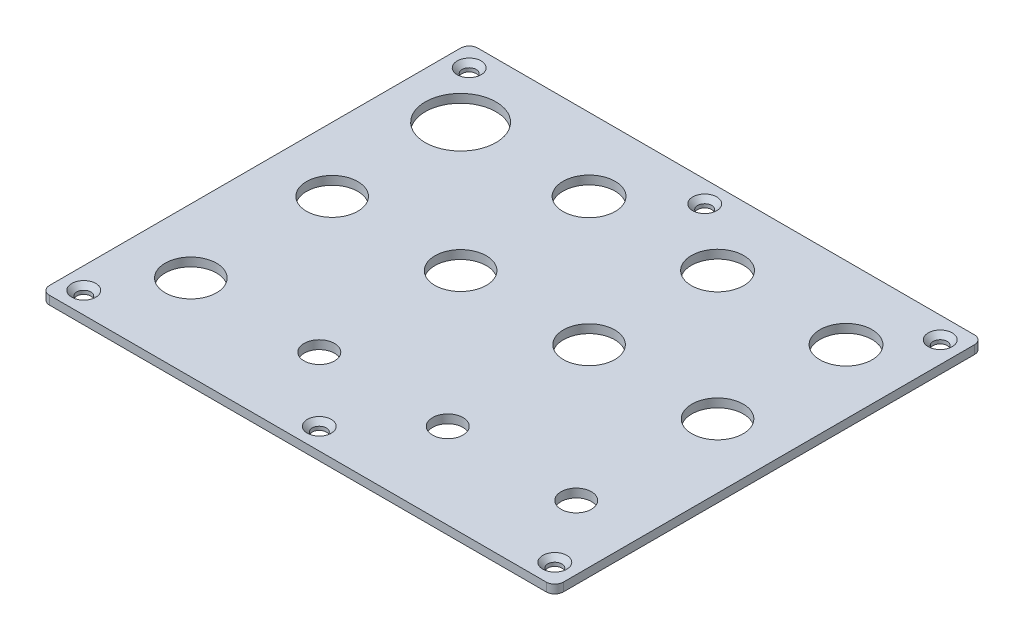
from build123d import *

# Parameters (mm, degrees)
BOTTOM_PLATE_W                       = 120
BOTTOM_PLATE_H                       = 100
BOTTOM_PLATE_EXT_DEPTH               = 2
MIDDLE_ROW_R                         = 6
MIDDLE_ROW_CUT_DEPTH                 = 157.217796681
TOP_ROW_R                            = 8.25
TOP_ROW_R_2                          = 6.1
TOP_ROW_CUT_DEPTH                    = 157.217796681
BOTTOM_ROW_R                         = 3.55
BOTTOM_ROW_R_2                       = 6
BOTTOM_ROW_CUT_DEPTH                 = 157.217796681
PLATE_SCREWS_R                       = 1.65
PLATE_SCREWS_CUT_DEPTH               = 157.217796681
PLATE_SCREW_HEAD_R                   = 2.8
PLATE_SCREW_HEAD_CUT_DEPTH           = 2
PLATE_SCREW_HEAD_CUT_DRAFT           = -45
PLATE_SCREW_HEAD_CUT_PROFILE_2_DEPTH = 2
PLATE_SCREW_HEAD_CUT_PROFILE_2_DRAFT = -45
PLATE_SCREW_HEAD_CUT_PROFILE_3_DEPTH = 2
PLATE_SCREW_HEAD_CUT_PROFILE_3_DRAFT = -45
PLATE_SCREW_HEAD_CUT_PROFILE_4_DEPTH = 2
PLATE_SCREW_HEAD_CUT_PROFILE_4_DRAFT = -45
PLATE_SCREW_HEAD_CUT_PROFILE_5_DEPTH = 2
PLATE_SCREW_HEAD_CUT_PROFILE_5_DRAFT = -45
PLATE_SCREW_HEAD_CUT_PROFILE_6_DEPTH = 2
PLATE_SCREW_HEAD_CUT_PROFILE_6_DRAFT = -45
FILLET1_R                            = 2
FILLET2_R                            = 2
FILLET3_R                            = 2
FILLET4_R                            = 2


with BuildPart() as part:
    # Bottom Plate → Bottom Plate EXT (new body)
    with BuildSketch(Plane(origin=(0, 0, 0), x_dir=(1, 0, 0), z_dir=(0, 1, 0))):
        with Locations((-60, 50)):
            Rectangle(BOTTOM_PLATE_W, BOTTOM_PLATE_H)
    extrude(amount=BOTTOM_PLATE_EXT_DEPTH)

    # Middle Row → Middle Row Cut (cut, through all)
    with BuildSketch(Plane(origin=(0, 2, 0), x_dir=(1, 0, 0), z_dir=(0, 1, 0))):
        with Locations(Location((-105, 53, 0), (0, 0, 270))):
            Circle(MIDDLE_ROW_R)
        with Locations(Location((-75, 53, 0), (0, 0, 270))):
            Circle(MIDDLE_ROW_R)
        with Locations(Location((-45, 53, 0), (0, 0, 270))):
            Circle(MIDDLE_ROW_R)
        with Locations(Location((-15, 53, 0), (0, 0, 270))):
            Circle(MIDDLE_ROW_R)
    extrude(amount=-MIDDLE_ROW_CUT_DEPTH, mode=Mode.SUBTRACT)

    # Top Row → Top Row Cut (cut, through all)
    with BuildSketch(Plane(origin=(0, 2, 0), x_dir=(1, 0, 0), z_dir=(0, 1, 0))):
        with Locations(Location((-105, 83, 0), (0, 0, 270))):
            Circle(TOP_ROW_R)
        with Locations(Location((-75, 83, 0), (0, 0, 270))):
            Circle(TOP_ROW_R_2)
        with Locations(Location((-45, 83, 0), (0, 0, 270))):
            Circle(TOP_ROW_R_2)
        with Locations(Location((-15, 83, 0), (0, 0, 270))):
            Circle(TOP_ROW_R_2)
    extrude(amount=-TOP_ROW_CUT_DEPTH, mode=Mode.SUBTRACT)

    # Bottom Row → Bottom Row Cut (cut, through all)
    with BuildSketch(Plane(origin=(0, 2, 0), x_dir=(1, 0, 0), z_dir=(0, 1, 0))):
        with Locations(Location((-75, 20, 0), (0, 0, 270))):
            Circle(BOTTOM_ROW_R)
        with Locations(Location((-45, 20, 0), (0, 0, 270))):
            Circle(BOTTOM_ROW_R)
        with Locations(Location((-15, 20, 0), (0, 0, 270))):
            Circle(BOTTOM_ROW_R)
        with Locations(Location((-105, 20, 0), (0, 0, 270))):
            Circle(BOTTOM_ROW_R_2)
    extrude(amount=-BOTTOM_ROW_CUT_DEPTH, mode=Mode.SUBTRACT)

    # Plate Screws → Plate Screws Cut (cut, through all)
    with BuildSketch(Plane(origin=(0, 2, 0), x_dir=(1, 0, 0), z_dir=(0, 1, 0))):
        with Locations(Location((-115, 95, 0), (0, 0, 270))):
            Circle(PLATE_SCREWS_R)
        with Locations(Location((-5, 95, 0), (0, 0, 270))):
            Circle(PLATE_SCREWS_R)
        with Locations(Location((-5, 5, 0), (0, 0, 270))):
            Circle(PLATE_SCREWS_R)
        with Locations(Location((-115, 5, 0), (0, 0, 270))):
            Circle(PLATE_SCREWS_R)
        with Locations(Location((-60, 95, 0), (0, 0, 270))):
            Circle(PLATE_SCREWS_R)
        with Locations(Location((-60, 5, 0), (0, 0, 90))):
            Circle(PLATE_SCREWS_R)
    extrude(amount=-PLATE_SCREWS_CUT_DEPTH, mode=Mode.SUBTRACT)


with BuildPart() as plate_screw_head_cut_tool:
    # Plate Screw Head → Plate Screw Head Cut (with draft: the straight prism first)
    with BuildSketch(Plane(origin=(0, 2, 0), x_dir=(1, 0, 0), z_dir=(0, 1, 0))):
        with Locations((-115, 95)):
            Circle(PLATE_SCREW_HEAD_R)
    extrude(amount=-PLATE_SCREW_HEAD_CUT_DEPTH)
    # Plate Screw Head Cut: the draft: its side faces are tilted about the plane it starts from
    plate_screw_head_cut_sides = [plate_screw_head_cut_tool.faces().sort_by_distance(p)[0] for p in [
        (-117.8, 1, -95),
    ]]
    draft(plate_screw_head_cut_sides, Plane(origin=(0, 2, 0), x_dir=(1, 0, 0), z_dir=(0, 1, 0)), PLATE_SCREW_HEAD_CUT_DRAFT)


with BuildPart() as part_1:
    add(part.part)

    # Plate Screw Head Cut: cut by plate_screw_head_cut_tool
    add(plate_screw_head_cut_tool.part, mode=Mode.SUBTRACT)


with BuildPart() as plate_screw_head_cut_profile_2_tool:
    # Plate Screw Head → Plate Screw Head Cut profile 2 (with draft: the straight prism first)
    with BuildSketch(Plane(origin=(0, 2, 0), x_dir=(1, 0, 0), z_dir=(0, 1, 0))):
        with Locations((-5, 95)):
            Circle(PLATE_SCREW_HEAD_R)
    extrude(amount=-PLATE_SCREW_HEAD_CUT_PROFILE_2_DEPTH)
    # Plate Screw Head Cut profile 2: the draft: its side faces are tilted about the plane it starts from
    plate_screw_head_cut_profile_2_sides = [plate_screw_head_cut_profile_2_tool.faces().sort_by_distance(p)[0] for p in [
        (-7.8, 1, -95),
    ]]
    draft(plate_screw_head_cut_profile_2_sides, Plane(origin=(0, 2, 0), x_dir=(1, 0, 0), z_dir=(0, 1, 0)), PLATE_SCREW_HEAD_CUT_PROFILE_2_DRAFT)


with BuildPart() as part_2:
    add(part_1.part)

    # Plate Screw Head Cut profile 2: cut by plate_screw_head_cut_profile_2_tool
    add(plate_screw_head_cut_profile_2_tool.part, mode=Mode.SUBTRACT)


with BuildPart() as plate_screw_head_cut_profile_3_tool:
    # Plate Screw Head → Plate Screw Head Cut profile 3 (with draft: the straight prism first)
    with BuildSketch(Plane(origin=(0, 2, 0), x_dir=(1, 0, 0), z_dir=(0, 1, 0))):
        with Locations((-5, 5)):
            Circle(PLATE_SCREW_HEAD_R)
    extrude(amount=-PLATE_SCREW_HEAD_CUT_PROFILE_3_DEPTH)
    # Plate Screw Head Cut profile 3: the draft: its side faces are tilted about the plane it starts from
    plate_screw_head_cut_profile_3_sides = [plate_screw_head_cut_profile_3_tool.faces().sort_by_distance(p)[0] for p in [
        (-7.8, 1, -5),
    ]]
    draft(plate_screw_head_cut_profile_3_sides, Plane(origin=(0, 2, 0), x_dir=(1, 0, 0), z_dir=(0, 1, 0)), PLATE_SCREW_HEAD_CUT_PROFILE_3_DRAFT)


with BuildPart() as part_3:
    add(part_2.part)

    # Plate Screw Head Cut profile 3: cut by plate_screw_head_cut_profile_3_tool
    add(plate_screw_head_cut_profile_3_tool.part, mode=Mode.SUBTRACT)


with BuildPart() as plate_screw_head_cut_profile_4_tool:
    # Plate Screw Head → Plate Screw Head Cut profile 4 (with draft: the straight prism first)
    with BuildSketch(Plane(origin=(0, 2, 0), x_dir=(1, 0, 0), z_dir=(0, 1, 0))):
        with Locations((-115, 5)):
            Circle(PLATE_SCREW_HEAD_R)
    extrude(amount=-PLATE_SCREW_HEAD_CUT_PROFILE_4_DEPTH)
    # Plate Screw Head Cut profile 4: the draft: its side faces are tilted about the plane it starts from
    plate_screw_head_cut_profile_4_sides = [plate_screw_head_cut_profile_4_tool.faces().sort_by_distance(p)[0] for p in [
        (-117.8, 1, -5),
    ]]
    draft(plate_screw_head_cut_profile_4_sides, Plane(origin=(0, 2, 0), x_dir=(1, 0, 0), z_dir=(0, 1, 0)), PLATE_SCREW_HEAD_CUT_PROFILE_4_DRAFT)


with BuildPart() as part_4:
    add(part_3.part)

    # Plate Screw Head Cut profile 4: cut by plate_screw_head_cut_profile_4_tool
    add(plate_screw_head_cut_profile_4_tool.part, mode=Mode.SUBTRACT)


with BuildPart() as plate_screw_head_cut_profile_5_tool:
    # Plate Screw Head → Plate Screw Head Cut profile 5 (with draft: the straight prism first)
    with BuildSketch(Plane(origin=(0, 2, 0), x_dir=(1, 0, 0), z_dir=(0, 1, 0))):
        with Locations((-60, 95)):
            Circle(PLATE_SCREW_HEAD_R)
    extrude(amount=-PLATE_SCREW_HEAD_CUT_PROFILE_5_DEPTH)
    # Plate Screw Head Cut profile 5: the draft: its side faces are tilted about the plane it starts from
    plate_screw_head_cut_profile_5_sides = [plate_screw_head_cut_profile_5_tool.faces().sort_by_distance(p)[0] for p in [
        (-62.8, 1, -95),
    ]]
    draft(plate_screw_head_cut_profile_5_sides, Plane(origin=(0, 2, 0), x_dir=(1, 0, 0), z_dir=(0, 1, 0)), PLATE_SCREW_HEAD_CUT_PROFILE_5_DRAFT)


with BuildPart() as part_5:
    add(part_4.part)

    # Plate Screw Head Cut profile 5: cut by plate_screw_head_cut_profile_5_tool
    add(plate_screw_head_cut_profile_5_tool.part, mode=Mode.SUBTRACT)


with BuildPart() as plate_screw_head_cut_profile_6_tool:
    # Plate Screw Head → Plate Screw Head Cut profile 6 (with draft: the straight prism first)
    with BuildSketch(Plane(origin=(0, 2, 0), x_dir=(1, 0, 0), z_dir=(0, 1, 0))):
        with Locations((-60, 5)):
            Circle(PLATE_SCREW_HEAD_R)
    extrude(amount=-PLATE_SCREW_HEAD_CUT_PROFILE_6_DEPTH)
    # Plate Screw Head Cut profile 6: the draft: its side faces are tilted about the plane it starts from
    plate_screw_head_cut_profile_6_sides = [plate_screw_head_cut_profile_6_tool.faces().sort_by_distance(p)[0] for p in [
        (-62.8, 1, -5),
    ]]
    draft(plate_screw_head_cut_profile_6_sides, Plane(origin=(0, 2, 0), x_dir=(1, 0, 0), z_dir=(0, 1, 0)), PLATE_SCREW_HEAD_CUT_PROFILE_6_DRAFT)


with BuildPart() as part_6:
    add(part_5.part)

    # Plate Screw Head Cut profile 6: cut by plate_screw_head_cut_profile_6_tool
    add(plate_screw_head_cut_profile_6_tool.part, mode=Mode.SUBTRACT)

    # Fillet1
    fillet1_edges = [part_6.edges().sort_by_distance(p)[0] for p in [
        (-120, 1, -100),
    ]]
    fillet(fillet1_edges, radius=FILLET1_R)

    # Fillet2
    fillet2_edges = [part_6.edges().sort_by_distance(p)[0] for p in [
        (0, 1, -100),
    ]]
    fillet(fillet2_edges, radius=FILLET2_R)

    # Fillet3
    fillet3_edges = [part_6.edges().sort_by_distance(p)[0] for p in [
        (0, 1, 0),
    ]]
    fillet(fillet3_edges, radius=FILLET3_R)

    # Fillet4
    fillet4_edges = [part_6.edges().sort_by_distance(p)[0] for p in [
        (-120, 1, 0),
    ]]
    fillet(fillet4_edges, radius=FILLET4_R)


solid = part_6.part
